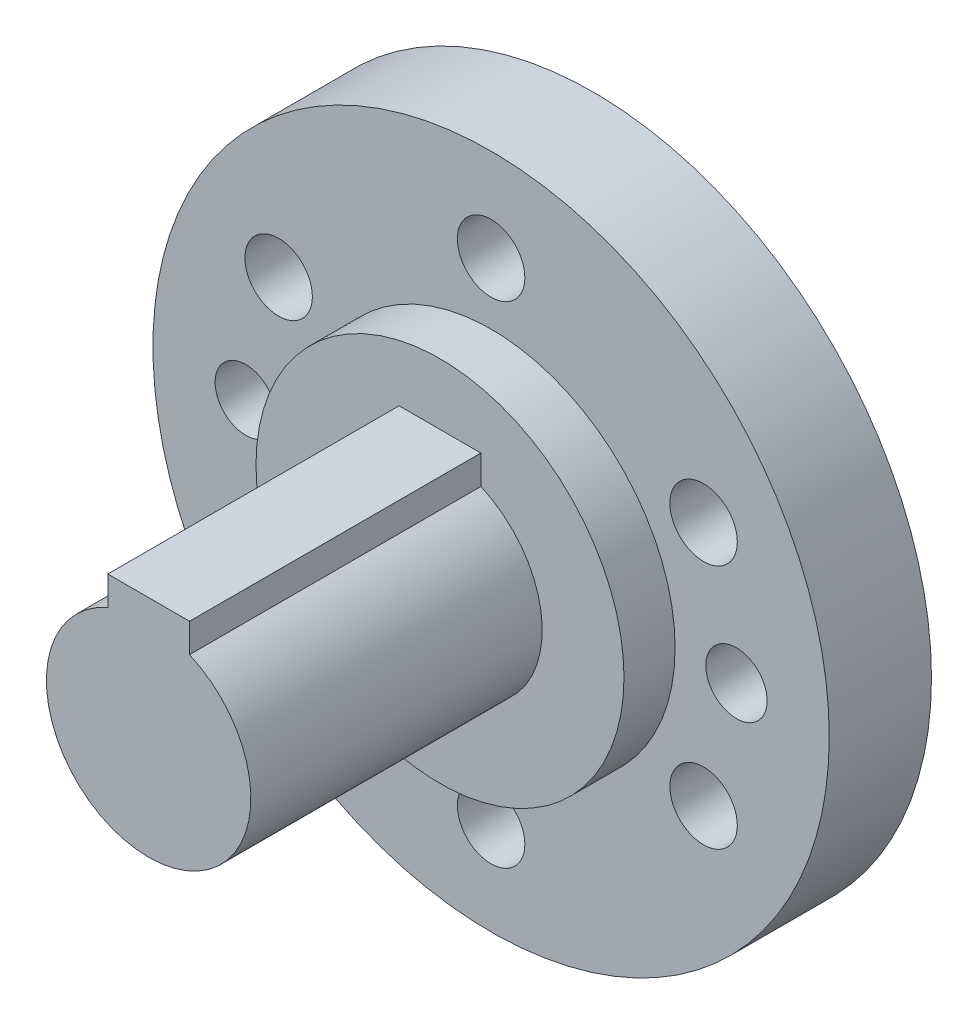
from build123d import *

# Parameters (mm, degrees)
SKETCH1_R           = 16.539827403
BOSS_EXTRUDE1_DEPTH = 2.5
SKETCH3_R           = 9
BOSS_EXTRUDE3_DEPTH = 2.5
BOSS_EXTRUDE5_DEPTH = 14.25


with BuildPart() as part:
    # Sketch1 → Boss-Extrude1 (new, symmetric)
    with BuildSketch(Plane.XY):
        Circle(SKETCH1_R)
        with BuildLine():
            ThreePointArc((9, 0), (0, 9), (-9, 0))
            ThreePointArc((-9, 0), (0, -9), (9, 0))
        make_face(mode=Mode.SUBTRACT)
        with BuildLine():
            ThreePointArc((1.65, 12), (0, 13.65), (-1.65, 12))
            ThreePointArc((-1.65, 12), (0, 10.35), (1.65, 12))
        make_face(mode=Mode.SUBTRACT)
        with BuildLine():
            ThreePointArc((11.217304845, 4.571058084), (11.821246762, 6.825), (9.567304845, 7.428941916))
            ThreePointArc((9.567304845, 7.428941916), (8.963362929, 5.175), (11.217304845, 4.571058084))
        make_face(mode=Mode.SUBTRACT)
        with BuildLine():
            ThreePointArc((9.567304845, -7.428941916), (11.821246762, -6.825), (11.217304845, -4.571058084))
            ThreePointArc((11.217304845, -4.571058084), (8.963362929, -5.175), (9.567304845, -7.428941916))
        make_face(mode=Mode.SUBTRACT)
        with BuildLine():
            ThreePointArc((-1.65, -12), (0, -13.65), (1.65, -12))
            ThreePointArc((1.65, -12), (0, -10.35), (-1.65, -12))
        make_face(mode=Mode.SUBTRACT)
        with BuildLine():
            ThreePointArc((-11.217304845, -4.571058084), (-11.821246762, -6.825), (-9.567304845, -7.428941916))
            ThreePointArc((-9.567304845, -7.428941916), (-8.963362929, -5.175), (-11.217304845, -4.571058084))
        make_face(mode=Mode.SUBTRACT)
        with BuildLine():
            ThreePointArc((-9.567304845, 7.428941916), (-11.821246762, 6.825), (-11.217304845, 4.571058084))
            ThreePointArc((-11.217304845, 4.571058084), (-8.963362929, 5.175), (-9.567304845, 7.428941916))
        make_face(mode=Mode.SUBTRACT)
        with BuildLine():
            ThreePointArc((13.5, 0), (12, 1.5), (10.5, 0))
            ThreePointArc((10.5, 0), (12, -1.5), (13.5, 0))
        make_face(mode=Mode.SUBTRACT)
        with BuildLine():
            ThreePointArc((-10.5, 0), (-12, 1.5), (-13.5, 0))
            ThreePointArc((-13.5, 0), (-12, -1.5), (-10.5, 0))
        make_face(mode=Mode.SUBTRACT)
    extrude(amount=BOSS_EXTRUDE1_DEPTH, both=True)

    # Sketch3 → Boss-Extrude3 (add, symmetric)
    with BuildSketch(Plane.XY.offset(2.5)):
        Circle(SKETCH3_R)
    extrude(amount=BOSS_EXTRUDE3_DEPTH, both=True)

    # Sketch4 → Boss-Extrude5 (add)
    with BuildSketch(Plane.XY.offset(5)):
        with BuildLine():
            Line((-2, 4.582575695), (-2, 6))
            Line((-2, 6), (2, 6))
            Line((2, 6), (2, 4.582575695))
            ThreePointArc((2, 4.582575695), (0, -5), (-2, 4.582575695))
        make_face()
    extrude(amount=BOSS_EXTRUDE5_DEPTH)


solid = part.part
